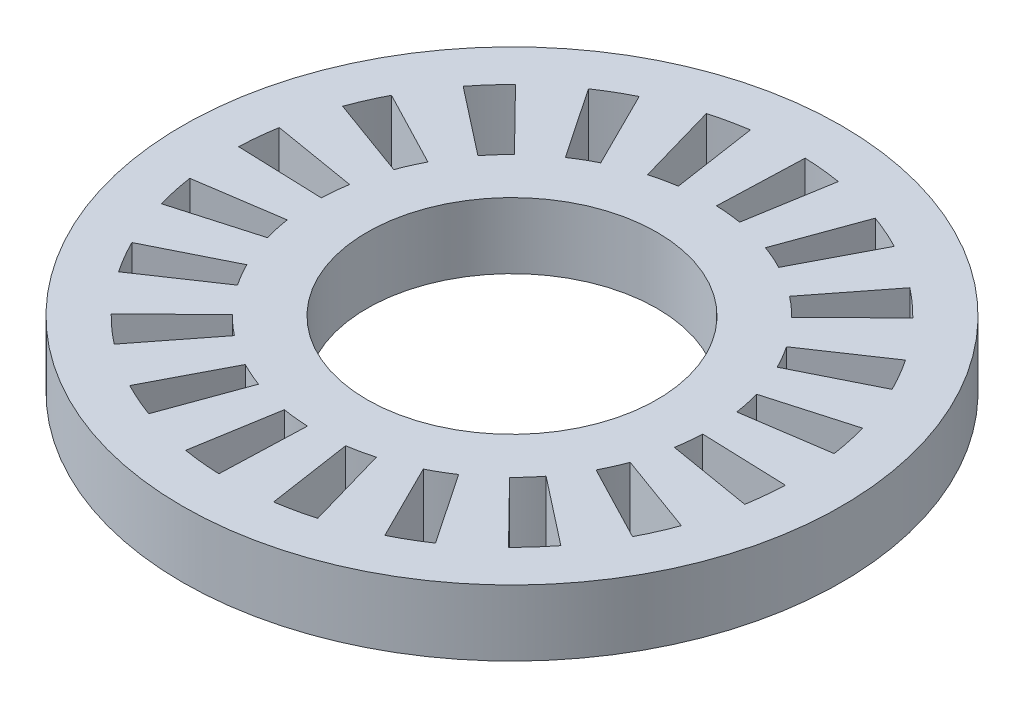
from build123d import *

# Parameters (mm, degrees)
SKETCH1_R           = 12.7
SKETCH1_R_2         = 5.588
BOSS_EXTRUDE1_DEPTH = 2.54


with BuildPart() as part:
    # Sketch1 → Boss-Extrude1 (new body)
    with BuildSketch(Plane(origin=(0, 0, 0), x_dir=(1, 0, 0), z_dir=(0, 1, 0))):
        with Locations(Location((0, 0, 0), (0, 0, 270))):
            Circle(SKETCH1_R)
        with Locations(Location((0, 0, 0), (0, 0, 270))):
            Circle(SKETCH1_R_2, mode=Mode.SUBTRACT)
        with BuildLine():
            Line((-9.68793232, 5.043218354), (-6.759022549, 3.518524433))
            ThreePointArc((-6.759022549, 3.518524433), (-6.974673471, 3.068929777), (-7.16045777, 2.606193492))
            Line((-7.16045777, 2.606193492), (-10.263322804, 3.735544005))
            ThreePointArc((-10.263322804, 3.735544005), (-9.997031975, 4.398799347), (-9.68793232, 5.043218354))
        make_face(mode=Mode.SUBTRACT)
        with BuildLine():
            Line((-8.606653451, 6.724254634), (-6.004641942, 4.691340442))
            ThreePointArc((-6.004641942, 4.691340442), (-5.684957198, 5.074018295), (-5.340928594, 5.434968423))
            Line((-5.340928594, 5.434968423), (-7.655330985, 7.790121406))
            ThreePointArc((-7.655330985, 7.790121406), (-8.14843865, 7.272759556), (-8.606653451, 6.724254634))
        make_face(mode=Mode.SUBTRACT)
        with BuildLine():
            Line((-6.107504892, 9.054748367), (-4.261049924, 6.317266303))
            ThreePointArc((-4.261049924, 6.317266303), (-3.838757705, 6.58242655), (-3.400027336, 6.819399835))
            Line((-3.400027336, 6.819399835), (-4.873372515, 9.774473097))
            ThreePointArc((-4.873372515, 9.774473097), (-5.502219377, 9.434811388), (-6.107504892, 9.054748367))
        make_face(mode=Mode.SUBTRACT)
        with BuildLine():
            Line((-3.0105112, 10.498900243), (-2.100356651, 7.324814123))
            ThreePointArc((-2.100356651, 7.324814123), (-1.616793862, 7.446501031), (-1.126307713, 7.536300879))
            Line((-1.126307713, 7.536300879), (-1.614374388, 10.80203126))
            ThreePointArc((-1.614374388, 10.80203126), (-2.317404535, 10.673318145), (-3.0105112, 10.498900243))
        make_face(mode=Mode.SUBTRACT)
        with BuildLine():
            Line((0.381172303, 10.915346613), (0.265934165, 7.615358102))
            ThreePointArc((0.265934165, 7.615358102), (0.763433029, 7.581660109), (1.257662757, 7.515496284))
            Line((1.257662757, 7.515496284), (1.802649951, 10.77221134))
            ThreePointArc((1.802649951, 10.77221134), (1.094254009, 10.867046156), (0.381172303, 10.915346613))
        make_face(mode=Mode.SUBTRACT)
        with BuildLine():
            Line((3.735544005, 10.263322804), (2.606193492, 7.16045777))
            ThreePointArc((2.606193492, 7.16045777), (3.068929777, 6.974673471), (3.518524433, 6.759022549))
            Line((3.518524433, 6.759022549), (5.043218354, 9.68793232))
            ThreePointArc((5.043218354, 9.68793232), (4.398799347, 9.997031975), (3.735544005, 10.263322804))
        make_face(mode=Mode.SUBTRACT)
        with BuildLine():
            Line((6.724254634, 8.606653451), (4.691340442, 6.004641942))
            ThreePointArc((4.691340442, 6.004641942), (5.074018295, 5.684957198), (5.434968423, 5.340928594))
            Line((5.434968423, 5.340928594), (7.790121406, 7.655330985))
            ThreePointArc((7.790121406, 7.655330985), (7.272759556, 8.14843865), (6.724254634, 8.606653451))
        make_face(mode=Mode.SUBTRACT)
        with BuildLine():
            Line((9.054748367, 6.107504892), (6.317266303, 4.261049924))
            ThreePointArc((6.317266303, 4.261049924), (6.58242655, 3.838757705), (6.819399835, 3.400027336))
            Line((6.819399835, 3.400027336), (9.774473097, 4.873372515))
            ThreePointArc((9.774473097, 4.873372515), (9.434811388, 5.502219377), (9.054748367, 6.107504892))
        make_face(mode=Mode.SUBTRACT)
        with BuildLine():
            Line((10.498900243, 3.0105112), (7.324814123, 2.100356651))
            ThreePointArc((7.324814123, 2.100356651), (7.446501031, 1.616793862), (7.536300879, 1.126307713))
            Line((7.536300879, 1.126307713), (10.80203126, 1.614374388))
            ThreePointArc((10.80203126, 1.614374388), (10.673318145, 2.317404535), (10.498900243, 3.0105112))
        make_face(mode=Mode.SUBTRACT)
        with BuildLine():
            Line((10.915346613, -0.381172303), (7.615358102, -0.265934165))
            ThreePointArc((7.615358102, -0.265934165), (7.581660109, -0.763433029), (7.515496284, -1.257662757))
            Line((7.515496284, -1.257662757), (10.77221134, -1.802649951))
            ThreePointArc((10.77221134, -1.802649951), (10.867046156, -1.094254009), (10.915346613, -0.381172303))
        make_face(mode=Mode.SUBTRACT)
        with BuildLine():
            Line((10.263322804, -3.735544005), (7.16045777, -2.606193492))
            ThreePointArc((7.16045777, -2.606193492), (6.974673471, -3.068929777), (6.759022549, -3.518524433))
            Line((6.759022549, -3.518524433), (9.68793232, -5.043218354))
            ThreePointArc((9.68793232, -5.043218354), (9.997031975, -4.398799347), (10.263322804, -3.735544005))
        make_face(mode=Mode.SUBTRACT)
        with BuildLine():
            Line((8.606653451, -6.724254634), (6.004641942, -4.691340442))
            ThreePointArc((6.004641942, -4.691340442), (5.684957198, -5.074018295), (5.340928594, -5.434968423))
            Line((5.340928594, -5.434968423), (7.655330985, -7.790121406))
            ThreePointArc((7.655330985, -7.790121406), (8.14843865, -7.272759556), (8.606653451, -6.724254634))
        make_face(mode=Mode.SUBTRACT)
        with BuildLine():
            Line((6.107504892, -9.054748367), (4.261049924, -6.317266303))
            ThreePointArc((4.261049924, -6.317266303), (3.838757705, -6.58242655), (3.400027336, -6.819399835))
            Line((3.400027336, -6.819399835), (4.873372515, -9.774473097))
            ThreePointArc((4.873372515, -9.774473097), (5.502219377, -9.434811388), (6.107504892, -9.054748367))
        make_face(mode=Mode.SUBTRACT)
        with BuildLine():
            Line((3.0105112, -10.498900243), (2.100356651, -7.324814123))
            ThreePointArc((2.100356651, -7.324814123), (1.616793862, -7.446501031), (1.126307713, -7.536300879))
            Line((1.126307713, -7.536300879), (1.614374388, -10.80203126))
            ThreePointArc((1.614374388, -10.80203126), (2.317404535, -10.673318145), (3.0105112, -10.498900243))
        make_face(mode=Mode.SUBTRACT)
        with BuildLine():
            Line((-0.381172303, -10.915346613), (-0.265934165, -7.615358102))
            ThreePointArc((-0.265934165, -7.615358102), (-0.763433029, -7.581660109), (-1.257662757, -7.515496284))
            Line((-1.257662757, -7.515496284), (-1.802649951, -10.77221134))
            ThreePointArc((-1.802649951, -10.77221134), (-1.094254009, -10.867046156), (-0.381172303, -10.915346613))
        make_face(mode=Mode.SUBTRACT)
        with BuildLine():
            Line((-3.735544005, -10.263322804), (-2.606193492, -7.16045777))
            ThreePointArc((-2.606193492, -7.16045777), (-3.068929777, -6.974673471), (-3.518524433, -6.759022549))
            Line((-3.518524433, -6.759022549), (-5.043218354, -9.68793232))
            ThreePointArc((-5.043218354, -9.68793232), (-4.398799347, -9.997031975), (-3.735544005, -10.263322804))
        make_face(mode=Mode.SUBTRACT)
        with BuildLine():
            Line((-6.724254634, -8.606653451), (-4.691340442, -6.004641942))
            ThreePointArc((-4.691340442, -6.004641942), (-5.074018295, -5.684957198), (-5.434968423, -5.340928594))
            Line((-5.434968423, -5.340928594), (-7.790121406, -7.655330985))
            ThreePointArc((-7.790121406, -7.655330985), (-7.272759556, -8.14843865), (-6.724254634, -8.606653451))
        make_face(mode=Mode.SUBTRACT)
        with BuildLine():
            Line((-9.054748367, -6.107504892), (-6.317266303, -4.261049924))
            ThreePointArc((-6.317266303, -4.261049924), (-6.58242655, -3.838757705), (-6.819399835, -3.400027336))
            Line((-6.819399835, -3.400027336), (-9.774473097, -4.873372515))
            ThreePointArc((-9.774473097, -4.873372515), (-9.434811388, -5.502219377), (-9.054748367, -6.107504892))
        make_face(mode=Mode.SUBTRACT)
        with BuildLine():
            Line((-10.498900243, -3.0105112), (-7.324814123, -2.100356651))
            ThreePointArc((-7.324814123, -2.100356651), (-7.446501031, -1.616793862), (-7.536300879, -1.126307713))
            Line((-7.536300879, -1.126307713), (-10.80203126, -1.614374388))
            ThreePointArc((-10.80203126, -1.614374388), (-10.673318145, -2.317404535), (-10.498900243, -3.0105112))
        make_face(mode=Mode.SUBTRACT)
        with BuildLine():
            Line((-10.915346613, 0.381172303), (-7.615358102, 0.265934165))
            ThreePointArc((-7.615358102, 0.265934165), (-7.581660109, 0.763433029), (-7.515496284, 1.257662757))
            Line((-7.515496284, 1.257662757), (-10.77221134, 1.802649951))
            ThreePointArc((-10.77221134, 1.802649951), (-10.867046156, 1.094254009), (-10.915346613, 0.381172303))
        make_face(mode=Mode.SUBTRACT)
    extrude(amount=BOSS_EXTRUDE1_DEPTH)


solid = part.part
